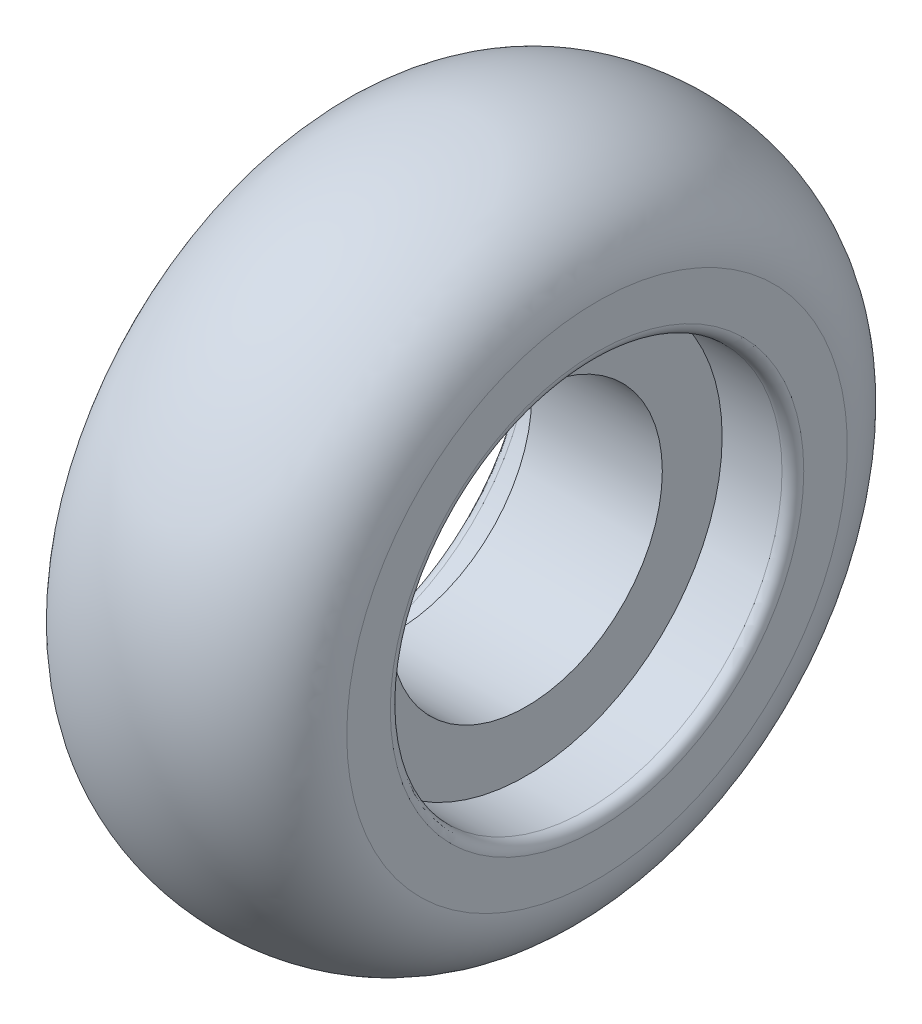
from build123d import *


with BuildPart() as part:
    # Szkic1 → Obrót1 (revolve)
    with BuildSketch(Plane.XY, mode=Mode.PRIVATE) as obr_t1_sk:
        with BuildLine():
            Line((-6, 12.5), (6, 12.5))
            Line((6, 12.5), (6, 18))
            Line((6, 18), (11.5, 18))
            ThreePointArc((11.5, 18), (12.207106781, 18.292893219), (12.5, 19))
            Line((12.5, 19), (12.5, 23))
            add(Edge.make_bspline(
                [(12.5, 23), (12.5, 31.5), (0, 31.5), (-12.5, 31.5), (-12.5, 23)],
                knots=[0, 0, 0, 1.570796327, 1.570796327, 3.141592654, 3.141592654, 3.141592654], degree=2, weights=[1, 0.707106781, 1, 0.707106781, 1]))
            Line((-12.5, 23), (-12.5, 19))
            ThreePointArc((-12.5, 19), (-12.207106781, 18.292893219), (-11.5, 18))
            Line((-11.5, 18), (-6, 18))
            Line((-6, 18), (-6, 12.5))
        make_face()
    revolve(obr_t1_sk.sketch.rotate(Axis((0, 0, 0), (1, 0, 0)), 90), axis=Axis((0, 0, 0), (1, 0, 0)))


solid = part.part
